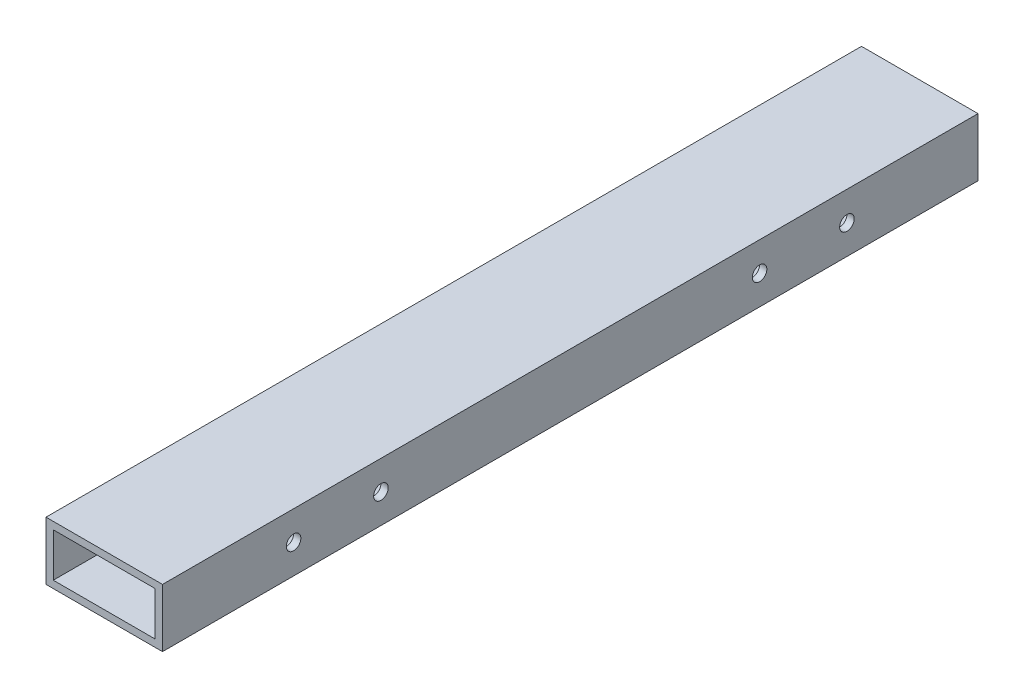
from build123d import *

# Parameters (mm, degrees)
SKETCH1_W               = 50.8
SKETCH1_H               = 25.4
SKETCH1_W_2             = 44.45
SKETCH1_H_2             = 19.05
BOSS_EXTRUDE1_DEPTH     = 355.6
CUT_EXTRUDE1_DEPTH      = 361.10715072
CUT_EXTRUDE1_DEPTH_BACK = 361.10715072
SKETCH2_R               = 3.175


with BuildPart() as part:
    # Sketch1 → Boss-Extrude1 (new body)
    with BuildSketch(Plane.XY):
        with Locations((25.4, 12.7)):
            Rectangle(SKETCH1_W, SKETCH1_H)
        with Locations((25.4, 12.7)):
            Rectangle(SKETCH1_W_2, SKETCH1_H_2, mode=Mode.SUBTRACT)
    extrude(amount=BOSS_EXTRUDE1_DEPTH)

    # Sketch2 → Cut-Extrude1 (cut, two sides: drawn at the far end of the back side and taken through both)
    with BuildSketch(Plane(origin=(50.8, 0, 0), x_dir=(0, 0, -1), z_dir=(1, 0, 0)).offset(-CUT_EXTRUDE1_DEPTH_BACK)):
        with Locations((-260.35, 12.7)):
            Circle(SKETCH2_R)
        with Locations((-298.45, 12.7)):
            Circle(SKETCH2_R)
        with Locations(Location((-57.15, 12.7, 0), (0, 0, 180))):
            Circle(SKETCH2_R)
        with Locations(Location((-95.25, 12.7, 0), (0, 0, 180))):
            Circle(SKETCH2_R)
    extrude(amount=CUT_EXTRUDE1_DEPTH + CUT_EXTRUDE1_DEPTH_BACK, mode=Mode.SUBTRACT)


solid = part.part
